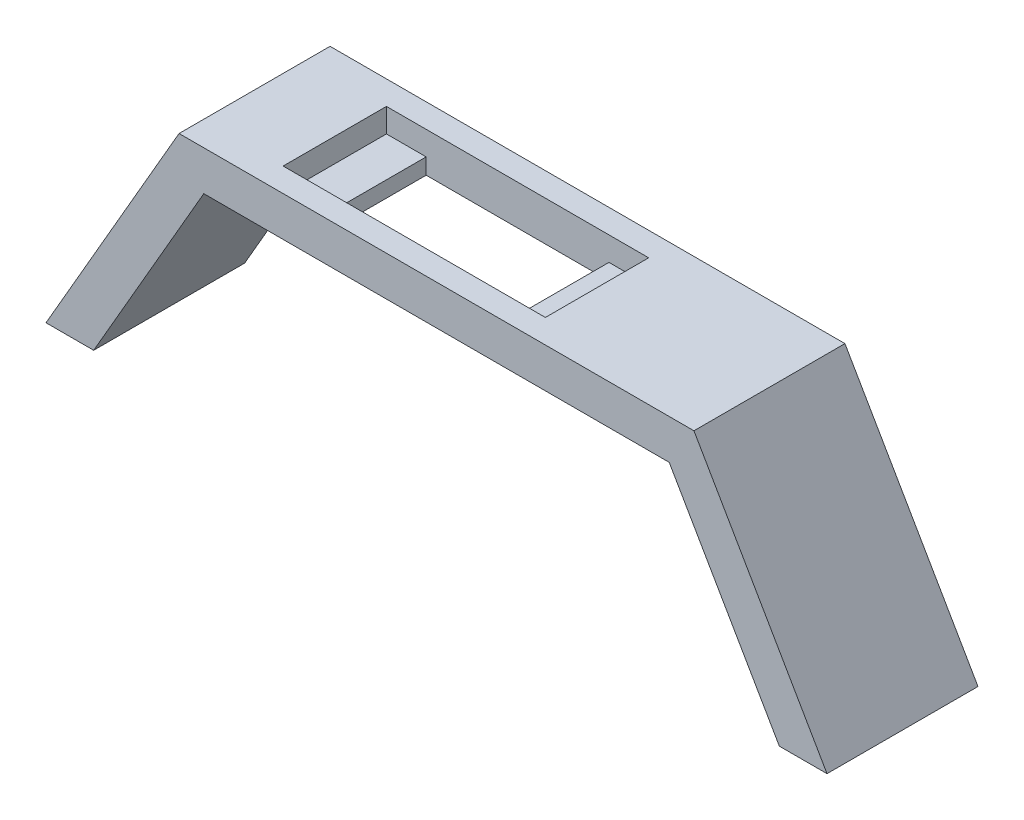
from build123d import *

# Parameters (mm, degrees)
BOSS_EXTRUDE1_DEPTH = 19
SKETCH2_W           = 33
SKETCH2_H           = 13
CUT_EXTRUDE1_DEPTH  = 3
CUT_EXTRUDE2_REACH  = 60.752
SKETCH3_W           = 23
SKETCH3_H           = 13


with BuildPart() as part:
    # Sketch1 → Boss-Extrude1 (new body)
    with BuildSketch(Plane.XY):
        Polygon((-29.283593539, 0), (29.283593539, 0), (43.14, -24), (49.14, -24), (32.396842194, 5), (-32.396842194, 5), (-49.14, -24), (-43.14, -24), align=None)
    extrude(amount=BOSS_EXTRUDE1_DEPTH)

    # Sketch2 → Cut-Extrude1 (cut)
    with BuildSketch(Plane(origin=(0, 5, 0), x_dir=(1, 0, 0), z_dir=(0, 1, 0))):
        with Locations((-5.8, -9.5)):
            Rectangle(SKETCH2_W, SKETCH2_H)
    extrude(amount=-CUT_EXTRUDE1_DEPTH, mode=Mode.SUBTRACT)

    # Sketch3 → Cut-Extrude2 (cut, up to next)
    with BuildSketch(Plane(origin=(0, 2, 0), x_dir=(1, 0, 0), z_dir=(0, 1, 0)), mode=Mode.PRIVATE) as cut_extrude2_sk1:
        with Locations((-5.8, -9.5)):
            Rectangle(SKETCH3_W, SKETCH3_H)
    cut_extrude2_tool1 = extrude(cut_extrude2_sk1.sketch, amount=-CUT_EXTRUDE2_REACH, mode=Mode.PRIVATE) & part.part
    add(cut_extrude2_tool1.solids().sort_by_distance((-5.8, 2, 9.5))[0], mode=Mode.SUBTRACT)


solid = part.part
